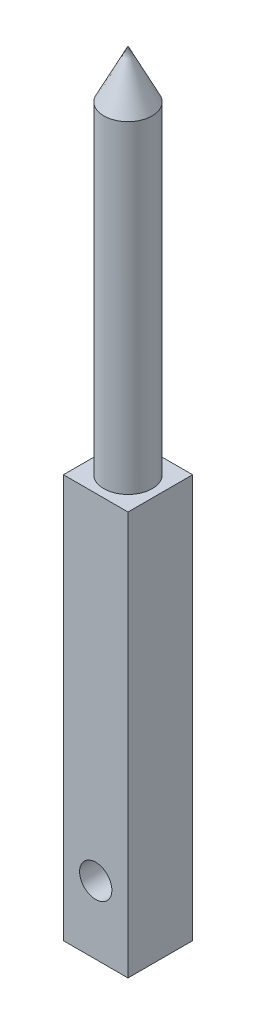
from build123d import *

# Parameters (mm, degrees)
ESQUISSE2_R             = 3
BOSS_EXTRU_1_DEPTH      = 90
ESQUISSE3_W             = 8
ESQUISSE3_H             = 8
BOSS_EXTRU_2_DEPTH      = 50
ESQUISSE8_R             = 2
ENL_V_MAT_EXTRU_4_DEPTH = 10


with BuildPart() as part:
    # Esquisse1 → Révolution1 (revolve)
    with BuildSketch(Plane.XY, mode=Mode.PRIVATE) as r_volution1_sk:
        Polygon((0, 0), (3, 0), (0, 6), align=None)
    revolve(r_volution1_sk.sketch.rotate(Axis((0, 0, 0), (0, 1, 0)), 90), axis=Axis((0, 0, 0), (0, 1, 0)))

    # Esquisse2 → Boss.-Extru.1 (add)
    with BuildSketch(Plane.XZ):
        with Locations(Location((0, 0, 0), (0, 0, 90))):
            Circle(ESQUISSE2_R)
    extrude(amount=BOSS_EXTRU_1_DEPTH)

    # Esquisse3 → Boss.-Extru.2 (add)
    with BuildSketch(Plane.XZ.offset(90)):
        Rectangle(ESQUISSE3_W, ESQUISSE3_H)
    extrude(amount=-BOSS_EXTRU_2_DEPTH)

    # Esquisse8 → Enlèv. mat.-Extru.4 (cut)
    with BuildSketch(Plane(origin=(0, 0, -4), x_dir=(-1, 0, 0), z_dir=(0, 0, -1))):
        with Locations((0, -81.574730925)):
            Circle(ESQUISSE8_R)
    extrude(amount=-ENL_V_MAT_EXTRU_4_DEPTH, mode=Mode.SUBTRACT)


solid = part.part
